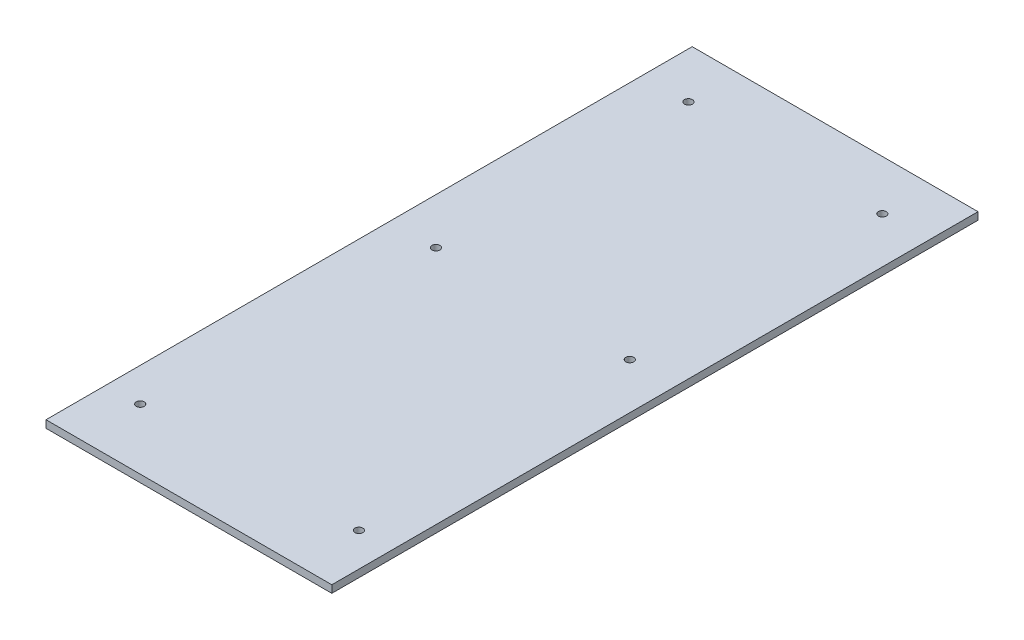
from build123d import *

# Parameters (mm, degrees)
ESQUISSE1_W             = 115
ESQUISSE1_H             = 260
BOSS_EXTRU_1_DEPTH      = 3
ENL_V_MAT_EXTRU_1_REACH = 238.902
ESQUISSE2_R             = 1.6


with BuildPart() as part:
    # Esquisse1 → Boss.-Extru.1 (new body)
    with BuildSketch(Plane(origin=(0, 0, 0), x_dir=(1, 0, 0), z_dir=(0, 1, 0))):
        with Locations((22.5745208, -92.938790058)):
            Rectangle(ESQUISSE1_W, ESQUISSE1_H)
    extrude(amount=BOSS_EXTRU_1_DEPTH)

    # Esquisse2 → Enlèv. mat.-Extru.1 (cut, up to next)
    with BuildSketch(Plane(origin=(0, 3, 0), x_dir=(1, 0, 0), z_dir=(0, 1, 0)), mode=Mode.PRIVATE) as enl_v_mat_extru_1_sk1:
        with Locations(Location((-21.4254792, -198.538790058, 0), (0, 0, 270))):
            Circle(ESQUISSE2_R)
    enl_v_mat_extru_1_tool1 = extrude(enl_v_mat_extru_1_sk1.sketch, amount=-ENL_V_MAT_EXTRU_1_REACH, mode=Mode.PRIVATE) & part.part
    # Esquisse2 → Enlèv. mat.-Extru.1 (cut, up to next)
    with BuildSketch(Plane(origin=(0, 3, 0), x_dir=(1, 0, 0), z_dir=(0, 1, 0)), mode=Mode.PRIVATE) as enl_v_mat_extru_1_sk2:
        with Locations(Location((66.5745208, -198.538790058, 0), (0, 0, 270))):
            Circle(ESQUISSE2_R)
    enl_v_mat_extru_1_tool2 = extrude(enl_v_mat_extru_1_sk2.sketch, amount=-ENL_V_MAT_EXTRU_1_REACH, mode=Mode.PRIVATE) & part.part
    # Esquisse2 → Enlèv. mat.-Extru.1 (cut, up to next)
    with BuildSketch(Plane(origin=(0, 3, 0), x_dir=(1, 0, 0), z_dir=(0, 1, 0)), mode=Mode.PRIVATE) as enl_v_mat_extru_1_sk3:
        with Locations(Location((-16.4254792, -84.538790058, 0), (0, 0, 270))):
            Circle(ESQUISSE2_R)
    enl_v_mat_extru_1_tool3 = extrude(enl_v_mat_extru_1_sk3.sketch, amount=-ENL_V_MAT_EXTRU_1_REACH, mode=Mode.PRIVATE) & part.part
    # Esquisse2 → Enlèv. mat.-Extru.1 (cut, up to next)
    with BuildSketch(Plane(origin=(0, 3, 0), x_dir=(1, 0, 0), z_dir=(0, 1, 0)), mode=Mode.PRIVATE) as enl_v_mat_extru_1_sk4:
        with Locations(Location((61.5745208, -84.538790058, 0), (0, 0, 270))):
            Circle(ESQUISSE2_R)
    enl_v_mat_extru_1_tool4 = extrude(enl_v_mat_extru_1_sk4.sketch, amount=-ENL_V_MAT_EXTRU_1_REACH, mode=Mode.PRIVATE) & part.part
    # Esquisse2 → Enlèv. mat.-Extru.1 (cut, up to next)
    with BuildSketch(Plane(origin=(0, 3, 0), x_dir=(1, 0, 0), z_dir=(0, 1, 0)), mode=Mode.PRIVATE) as enl_v_mat_extru_1_sk5:
        with Locations(Location((-16.4254792, 17.061209942, 0), (0, 0, 270))):
            Circle(ESQUISSE2_R)
    enl_v_mat_extru_1_tool5 = extrude(enl_v_mat_extru_1_sk5.sketch, amount=-ENL_V_MAT_EXTRU_1_REACH, mode=Mode.PRIVATE) & part.part
    # Esquisse2 → Enlèv. mat.-Extru.1 (cut, up to next)
    with BuildSketch(Plane(origin=(0, 3, 0), x_dir=(1, 0, 0), z_dir=(0, 1, 0)), mode=Mode.PRIVATE) as enl_v_mat_extru_1_sk6:
        with Locations(Location((61.5745208, 17.061209942, 0), (0, 0, 270))):
            Circle(ESQUISSE2_R)
    enl_v_mat_extru_1_tool6 = extrude(enl_v_mat_extru_1_sk6.sketch, amount=-ENL_V_MAT_EXTRU_1_REACH, mode=Mode.PRIVATE) & part.part
    add(enl_v_mat_extru_1_tool1.solids().sort_by_distance((-21.425479, 3, 198.53879))[0], mode=Mode.SUBTRACT)
    add(enl_v_mat_extru_1_tool2.solids().sort_by_distance((66.574521, 3, 198.53879))[0], mode=Mode.SUBTRACT)
    add(enl_v_mat_extru_1_tool3.solids().sort_by_distance((-16.425479, 3, 84.53879))[0], mode=Mode.SUBTRACT)
    add(enl_v_mat_extru_1_tool4.solids().sort_by_distance((61.574521, 3, 84.53879))[0], mode=Mode.SUBTRACT)
    add(enl_v_mat_extru_1_tool5.solids().sort_by_distance((-16.425479, 3, -17.06121))[0], mode=Mode.SUBTRACT)
    add(enl_v_mat_extru_1_tool6.solids().sort_by_distance((61.574521, 3, -17.06121))[0], mode=Mode.SUBTRACT)


solid = part.part
